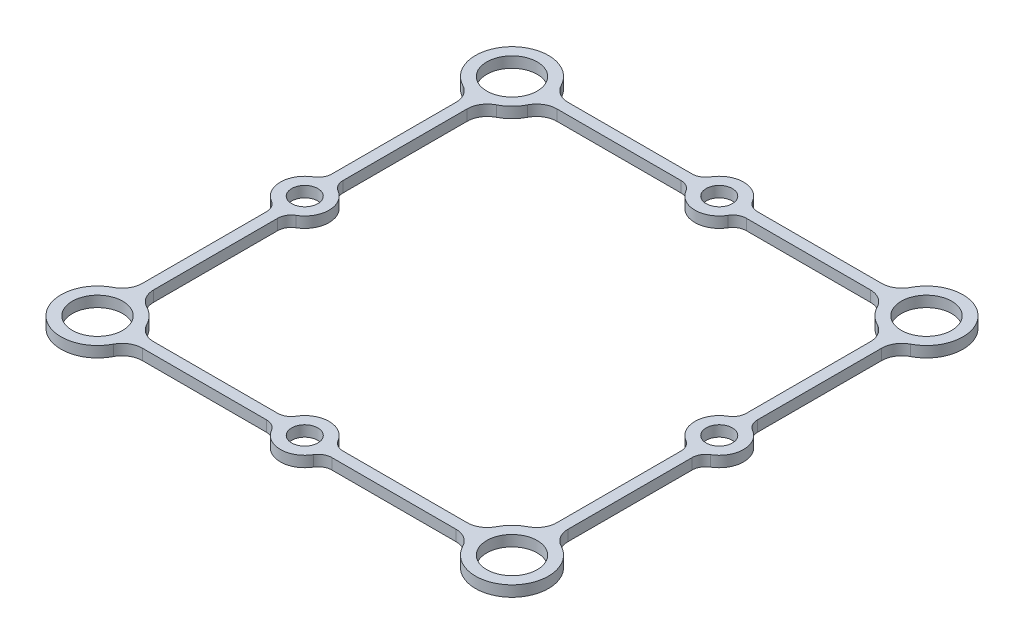
from build123d import *

# Parameters (mm, degrees)
SKETCH1_R           = 3.71
SKETCH1_R_2         = 1.925
BOSS_EXTRUDE1_DEPTH = 1.5875
FILLET3_R           = 3
FILLET4_R           = 2


with BuildPart() as part:
    # Sketch1 → Boss-Extrude1 (new body)
    with BuildSketch(Plane(origin=(0, 0, 0), x_dir=(1, 0, 0), z_dir=(0, 1, 0))):
        with BuildLine():
            Line((-25.148871697, 31.27), (-3.478505426, 31.27))
            ThreePointArc((-3.478505426, 31.27), (0, 34.02), (3.478505426, 31.27))
            Line((3.478505426, 31.27), (25.148871697, 31.27))
            ThreePointArc((25.148871697, 31.27), (34.235092347, 34.235092347), (31.27, 25.148871697))
            Line((31.27, 25.148871697), (31.27, 3.478505426))
            ThreePointArc((31.27, 3.478505426), (34.02, 0), (31.27, -3.478505426))
            Line((31.27, -3.478505426), (31.27, -25.148871697))
            ThreePointArc((31.27, -25.148871697), (34.235092347, -34.235092347), (25.148871697, -31.27))
            Line((25.148871697, -31.27), (3.478505426, -31.27))
            ThreePointArc((3.478505426, -31.27), (0, -34.02), (-3.478505426, -31.27))
            Line((-3.478505426, -31.27), (-25.148871697, -31.27))
            ThreePointArc((-25.148871697, -31.27), (-34.235092347, -34.235092347), (-31.27, -25.148871697))
            Line((-31.27, -25.148871697), (-31.27, -3.478505426))
            ThreePointArc((-31.27, -3.478505426), (-34.02, 0), (-31.27, 3.478505426))
            Line((-31.27, 3.478505426), (-31.27, 25.148871697))
            ThreePointArc((-31.27, 25.148871697), (-34.235092347, 34.235092347), (-25.148871697, 31.27))
        make_face()
        with Locations(Location((-30.445, 30.445, 0), (0, 0, 270))):
            Circle(SKETCH1_R, mode=Mode.SUBTRACT)
        with Locations(Location((30.445, 30.445, 0), (0, 0, 90))):
            Circle(SKETCH1_R, mode=Mode.SUBTRACT)
        with Locations(Location((30.445, -30.445, 0), (0, 0, 270))):
            Circle(SKETCH1_R, mode=Mode.SUBTRACT)
        with Locations(Location((-30.445, -30.445, 0), (0, 0, 90))):
            Circle(SKETCH1_R, mode=Mode.SUBTRACT)
        with Locations(Location((0, 30.445, 0), (0, 0, 270))):
            Circle(SKETCH1_R_2, mode=Mode.SUBTRACT)
        with Locations(Location((-30.445, 0, 0), (0, 0, 90))):
            Circle(SKETCH1_R_2, mode=Mode.SUBTRACT)
        with Locations(Location((0, -30.445, 0), (0, 0, 270))):
            Circle(SKETCH1_R_2, mode=Mode.SUBTRACT)
        with Locations(Location((30.445, 0, 0), (0, 0, 90))):
            Circle(SKETCH1_R_2, mode=Mode.SUBTRACT)
        with BuildLine():
            Line((-25.148871697, 29.62), (-3.478505426, 29.62))
            ThreePointArc((-3.478505426, 29.62), (0, 26.87), (3.478505426, 29.62))
            Line((3.478505426, 29.62), (25.148871697, 29.62))
            ThreePointArc((25.148871697, 29.62), (26.654907653, 26.654907653), (29.62, 25.148871697))
            Line((29.62, 25.148871697), (29.62, 3.478505426))
            ThreePointArc((29.62, 3.478505426), (26.87, 0), (29.62, -3.478505426))
            Line((29.62, -3.478505426), (29.62, -25.148871697))
            ThreePointArc((29.62, -25.148871697), (26.654907653, -26.654907653), (25.148871697, -29.62))
            Line((25.148871697, -29.62), (3.478505426, -29.62))
            ThreePointArc((3.478505426, -29.62), (0, -26.87), (-3.478505426, -29.62))
            Line((-3.478505426, -29.62), (-25.148871697, -29.62))
            ThreePointArc((-25.148871697, -29.62), (-26.654907653, -26.654907653), (-29.62, -25.148871697))
            Line((-29.62, -25.148871697), (-29.62, -3.478505426))
            ThreePointArc((-29.62, -3.478505426), (-26.87, 0), (-29.62, 3.478505426))
            Line((-29.62, 3.478505426), (-29.62, 25.148871697))
            ThreePointArc((-29.62, 25.148871697), (-26.654907653, 26.654907653), (-25.148871697, 29.62))
        make_face(mode=Mode.SUBTRACT)
    extrude(amount=BOSS_EXTRUDE1_DEPTH)

    # Fillet3
    fillet3_edges = [part.edges().sort_by_distance(p)[0] for p in [
        (-25.148871697, 0.79375, -31.27),
        (25.148871697, 0.79375, -31.27),
        (31.27, 0.79375, -25.148871697),
        (31.27, 0.79375, 25.148871697),
        (25.148871697, 0.79375, 31.27),
        (-25.148871697, 0.79375, 31.27),
        (-31.27, 0.79375, 25.148871697),
        (-31.27, 0.79375, -25.148871697),
        (-25.148871697, 0.79375, -29.62),
        (-29.62, 0.79375, -25.148871697),
        (-29.62, 0.79375, 25.148871697),
        (-25.148871697, 0.79375, 29.62),
        (25.148871697, 0.79375, 29.62),
        (29.62, 0.79375, 25.148871697),
        (29.62, 0.79375, -25.148871697),
        (25.148871697, 0.79375, -29.62),
    ]]
    fillet(fillet3_edges, radius=FILLET3_R)

    # Fillet4
    fillet4_edges = [part.edges().sort_by_distance(p)[0] for p in [
        (-3.478505426, 0.79375, -31.27),
        (3.478505426, 0.79375, -31.27),
        (31.27, 0.79375, -3.478505426),
        (31.27, 0.79375, 3.478505426),
        (3.478505426, 0.79375, 31.27),
        (-3.478505426, 0.79375, 31.27),
        (-31.27, 0.79375, 3.478505426),
        (-31.27, 0.79375, -3.478505426),
        (-29.62, 0.79375, -3.478505426),
        (-29.62, 0.79375, 3.478505426),
        (-3.478505426, 0.79375, 29.62),
        (3.478505426, 0.79375, 29.62),
        (29.62, 0.79375, 3.478505426),
        (29.62, 0.79375, -3.478505426),
        (3.478505426, 0.79375, -29.62),
        (-3.478505426, 0.79375, -29.62),
    ]]
    fillet(fillet4_edges, radius=FILLET4_R)


solid = part.part
